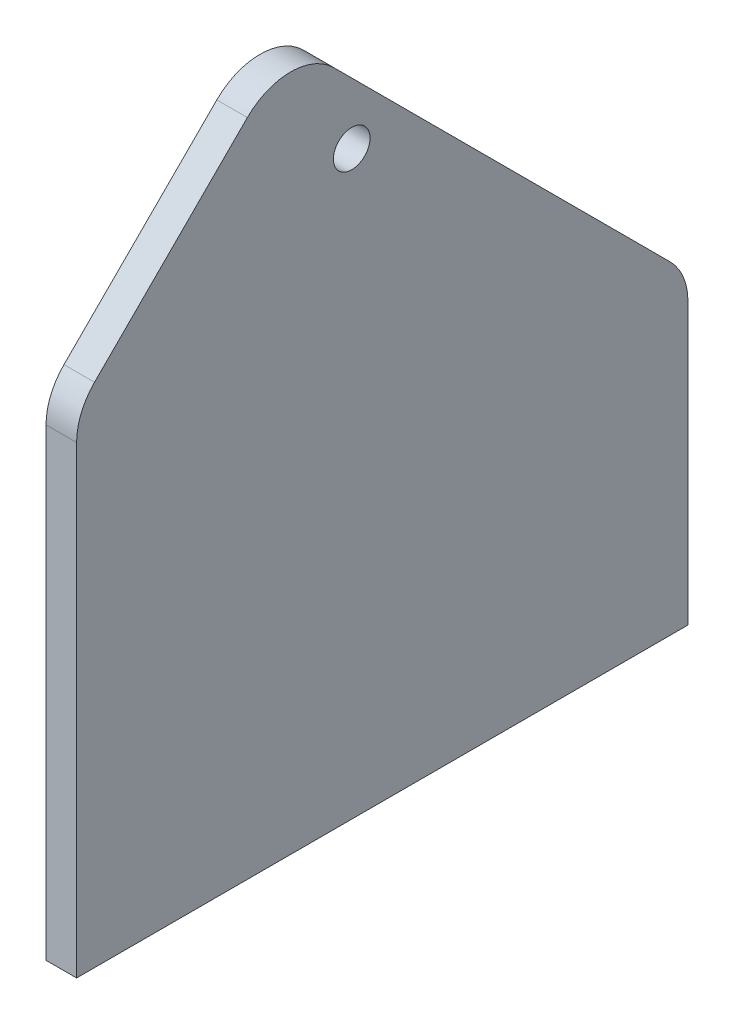
from build123d import *

# Parameters (mm, degrees)
EXTRUDE_1_DEPTH     = 5
SKETCH_2_R          = 3
CUT_EXTRUDE_1_DEPTH = 5
CUT_EXTRUDE_2_DEPTH = 10
FILLET_2_R          = 10


with BuildPart() as part:
    # 스케치1 → 보스-돌출1 (new body)
    with BuildSketch(Plane(origin=(0, 0, 0), x_dir=(0, 0, -1), z_dir=(1, 0, 0))):
        Polygon((0, 150), (100, 50), (100, 0), (0, 0), align=None)
    extrude(amount=EXTRUDE_1_DEPTH)

    # 스케치2 → 컷-돌출1 (cut)
    with BuildSketch(Plane(origin=(5, 0, 0), x_dir=(0, 0, -1), z_dir=(1, 0, 0))):
        with Locations((45, 95)):
            Circle(SKETCH_2_R)
    extrude(amount=-CUT_EXTRUDE_1_DEPTH, mode=Mode.SUBTRACT)

    # 스케치3 → 컷-돌출2 (cut)
    with BuildSketch(Plane(origin=(5, 0, 0), x_dir=(0, 0, -1), z_dir=(1, 0, 0))):
        Polygon((35, 115), (0, 80), (0, 150), align=None)
    extrude(amount=-CUT_EXTRUDE_2_DEPTH, mode=Mode.SUBTRACT)

    # 필렛2
    fillet_2_edges = [part.edges().sort_by_distance(p)[0] for p in [
        (2.5, 115, -35),
        (2.5, 80, 0),
        (2.5, 50, -100),
    ]]
    fillet(fillet_2_edges, radius=FILLET_2_R)


solid = part.part
